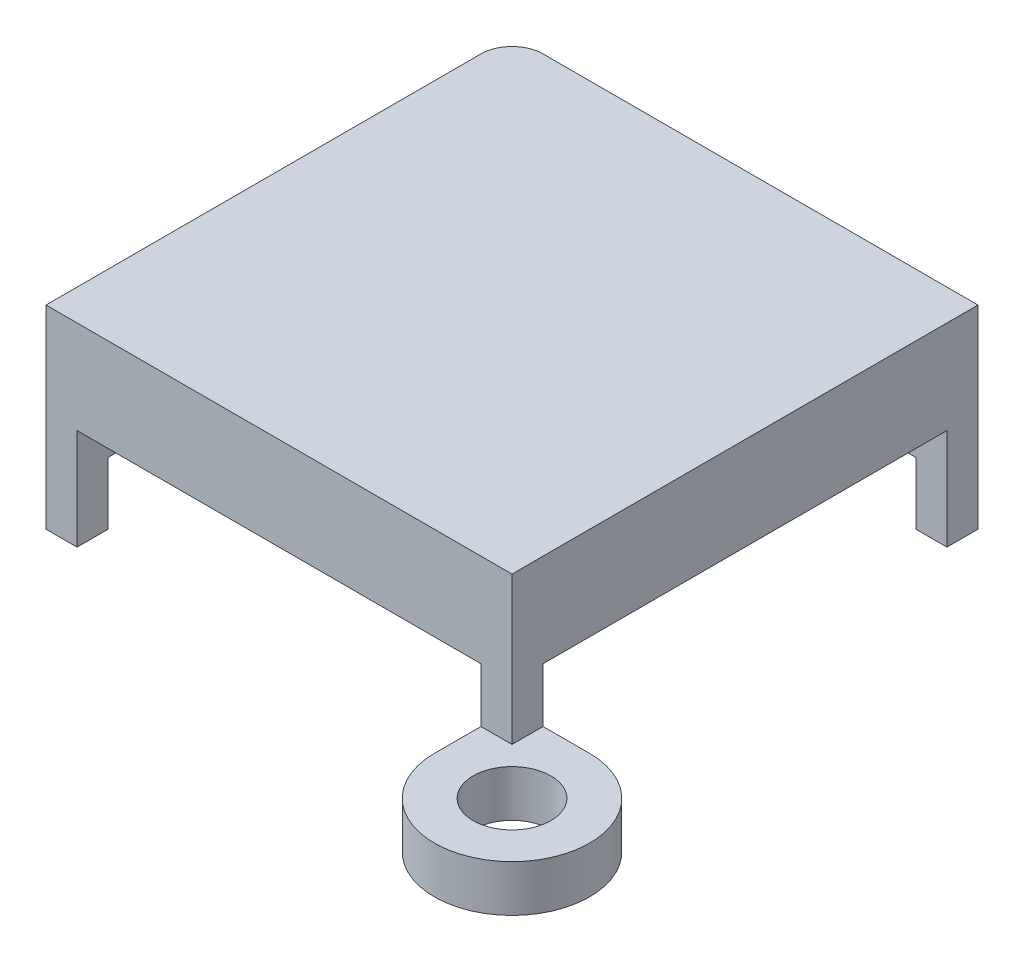
from build123d import *

# Parameters (mm, degrees)
SKETCH_1_W          = 6
SKETCH_1_H          = 6
EXTRUDE_1_DEPTH     = 0.5
SKETCH_2_W          = 6
SKETCH_2_H          = 6
SKETCH_2_W_2        = 5.2
SKETCH_2_H_2        = 5.2
EXTRUDE_2_DEPTH     = 2
SKETCH_3_W          = 5.2
SKETCH_3_H          = 1.8
CUT_EXTRUDE_1_DEPTH = 8
SKETCH_4_W          = 5.2
SKETCH_4_H          = 1.8
CUT_EXTRUDE_2_DEPTH = 8
SKETCH_5_R          = 0.5
EXTRUDE_3_DEPTH     = 0.6
SKETCH_6_W          = 5.2
SKETCH_6_H          = 0.4
EXTRUDE_4_DEPTH     = 0.5
SKETCH_7_W          = 0.4
SKETCH_7_H          = 5.2
EXTRUDE_5_DEPTH     = 0.5
SKETCH_8_W          = 0.4
SKETCH_8_H          = 5.2
EXTRUDE_6_DEPTH     = 1
SKETCH_9_W          = 5.2
SKETCH_9_H          = 0.4
EXTRUDE_7_DEPTH     = 1
SKETCH_10_W         = 0.4
SKETCH_10_H         = 1
SKETCH_10_W_2       = 1
SKETCH_10_H_2       = 0.4
CUT_EXTRUDE_3_DEPTH = 0.5
FILLET_2_R          = 0.4


with BuildPart() as part:
    # 草图1 → 凸台-拉伸1 (new body)
    with BuildSketch(Plane(origin=(0, 0, 0), x_dir=(1, 0, 0), z_dir=(0, 1, 0))):
        Rectangle(SKETCH_1_W, SKETCH_1_H)
    extrude(amount=EXTRUDE_1_DEPTH)

    # 草图2 → 凸台-拉伸2 (add)
    with BuildSketch(Plane.XZ):
        Rectangle(SKETCH_2_W, SKETCH_2_H)
        Rectangle(SKETCH_2_W_2, SKETCH_2_H_2, mode=Mode.SUBTRACT)
    extrude(amount=EXTRUDE_2_DEPTH)

    # 草图3 → 切除-拉伸1 (cut, through all)
    with BuildSketch(Plane.ZY.offset(3)):
        with Locations((0, -1.1)):
            Rectangle(SKETCH_3_W, SKETCH_3_H)
    extrude(amount=-CUT_EXTRUDE_1_DEPTH, mode=Mode.SUBTRACT)

    # 草图4 → 切除-拉伸2 (cut, through all)
    with BuildSketch(Plane(origin=(0, 0, -3), x_dir=(-1, 0, 0), z_dir=(0, 0, -1))):
        with Locations((0, -1.1)):
            Rectangle(SKETCH_4_W, SKETCH_4_H)
    extrude(amount=-CUT_EXTRUDE_2_DEPTH, mode=Mode.SUBTRACT)

    # 草图5 → 凸台-拉伸3 (add)
    with BuildSketch(Plane.XZ.offset(2)):
        with BuildLine():
            Line((3, 2.6), (3.6, 2.6))
            ThreePointArc((3.6, 2.6), (4.307106781, 4.307106781), (2.6, 3.6))
            Line((2.6, 3.6), (2.6, 3))
            Line((2.6, 3), (3, 3))
            Line((3, 3), (3, 2.6))
        make_face()
        with Locations(Location((3.6, 3.6, 0), (0, 0, 270))):
            Circle(SKETCH_5_R, mode=Mode.SUBTRACT)
    extrude(amount=-EXTRUDE_3_DEPTH)

    # 草图6 → 凸台-拉伸4 (add)
    with BuildSketch(Plane.XZ.offset(0.2)):
        with Locations((0, 2.8)):
            Rectangle(SKETCH_6_W, SKETCH_6_H)
    extrude(amount=EXTRUDE_4_DEPTH)

    # 草图7 → 凸台-拉伸5 (add)
    with BuildSketch(Plane.XZ.offset(0.2)):
        with Locations((2.8, 0)):
            Rectangle(SKETCH_7_W, SKETCH_7_H)
    extrude(amount=EXTRUDE_5_DEPTH)

    # 草图8 → 凸台-拉伸6 (add)
    with BuildSketch(Plane.XZ.offset(0.2)):
        with Locations((-2.8, 0)):
            Rectangle(SKETCH_8_W, SKETCH_8_H)
    extrude(amount=EXTRUDE_6_DEPTH)

    # 草图9 → 凸台-拉伸7 (add)
    with BuildSketch(Plane.XZ.offset(0.2)):
        with Locations((0, -2.8)):
            Rectangle(SKETCH_9_W, SKETCH_9_H)
    extrude(amount=EXTRUDE_7_DEPTH)

    # 草图10 → 切除-拉伸3 (cut)
    with BuildSketch(Plane.XZ.offset(1.2)):
        with Locations((-2.8, 0)):
            Rectangle(SKETCH_10_W, SKETCH_10_H)
        with Locations((0, -2.8)):
            Rectangle(SKETCH_10_W_2, SKETCH_10_H_2)
    extrude(amount=-CUT_EXTRUDE_3_DEPTH, mode=Mode.SUBTRACT)

    # 圆角2
    fillet_2_edges = [part.edges().sort_by_distance(p)[0] for p in [
        (-3, -0.75, -3),
    ]]
    fillet(fillet_2_edges, radius=FILLET_2_R)


solid = part.part
